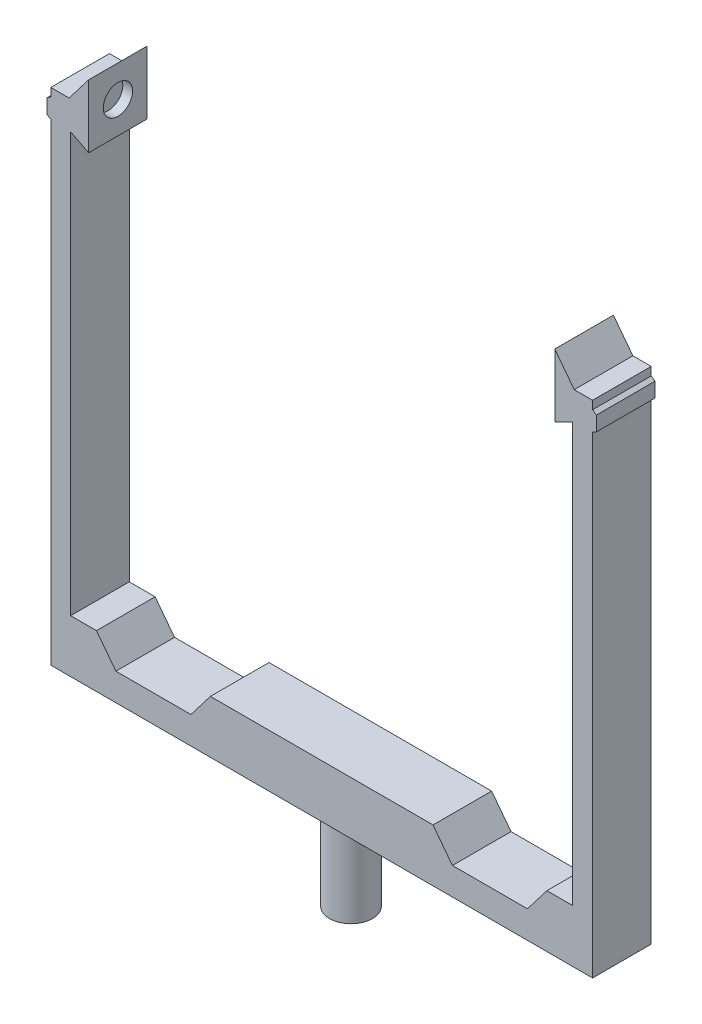
from build123d import *

# Parameters (mm, degrees)
BOSS_EXTRUDE1_DEPTH = 30
SKETCH2_R           = 11
BOSS_EXTRUDE2_DEPTH = 45
SKETCH3_R           = 7.5
CUT_EXTRUDE1_DEPTH  = 5
CUT_EXTRUDE2_START  = -5
SKETCH4_R           = 7.5
CUT_EXTRUDE2_DEPTH  = 5


with BuildPart() as part:
    # Sketch1 → Boss-Extrude1 (new body)
    with BuildSketch(Plane.XY):
        Polygon((164.243144092, -242.240505044), (107.282313119, -242.240505044), (107.282313119, -269.240505044), (245.890540796, -269.240505044), (245.890540796, -27.289352142), (247.838560611, -26.297684258), (247.838560611, -18.825937148), (245.890540796, -17.450821047), (245.890540796, -13.240505044), (236.499007707, -13.240505044), (226.537313119, -0.206413948), (226.537313119, -32.526046634), (235.73808569, -27.842259234), (235.73808569, -242.240505044), (222.507031976, -242.240505044), (212.571392529, -255.240505044), (174.178783539, -255.240505044), align=None)
        Polygon((107.282313119, -242.240505044), (50.321482145, -242.240505044), (40.385842698, -255.240505044), (1.993233708, -255.240505044), (-7.942405739, -242.240505044), (-21.173459453, -242.240505044), (-21.173459453, -27.842259234), (-11.972686881, -32.526046634), (-11.972686881, -0.206413948), (-21.93438147, -13.240505044), (-31.325914559, -13.240505044), (-31.325914559, -17.450821047), (-33.273934374, -18.825937148), (-33.273934374, -26.297684258), (-31.325914559, -27.289352142), (-31.325914559, -269.240505044), (107.282313119, -269.240505044), align=None)
    extrude(amount=BOSS_EXTRUDE1_DEPTH)

    # Sketch2 → Boss-Extrude2 (add)
    with BuildSketch(Plane.XZ.offset(269.240505044)):
        with Locations(Location((107.282313119, 15, 0), (0, 0, 90))):
            Circle(SKETCH2_R)
    extrude(amount=BOSS_EXTRUDE2_DEPTH)

    # Sketch3 → Cut-Extrude1 (cut)
    with BuildSketch(Plane(origin=(-11.972686881, 0, 0), x_dir=(0, 0, -1), z_dir=(1, 0, 0))):
        with Locations((-15, -16.366230291)):
            Circle(SKETCH3_R)
    extrude(amount=-CUT_EXTRUDE1_DEPTH, mode=Mode.SUBTRACT)

    # Sketch4 → Cut-Extrude2 (cut)
    with BuildSketch(Plane.ZY.offset(-226.537313119).offset(CUT_EXTRUDE2_START)):
        with Locations(Location((15, -16.366230291, 0), (0, 0, 180))):
            Circle(SKETCH4_R)
    extrude(amount=CUT_EXTRUDE2_DEPTH, mode=Mode.SUBTRACT)


solid = part.part
